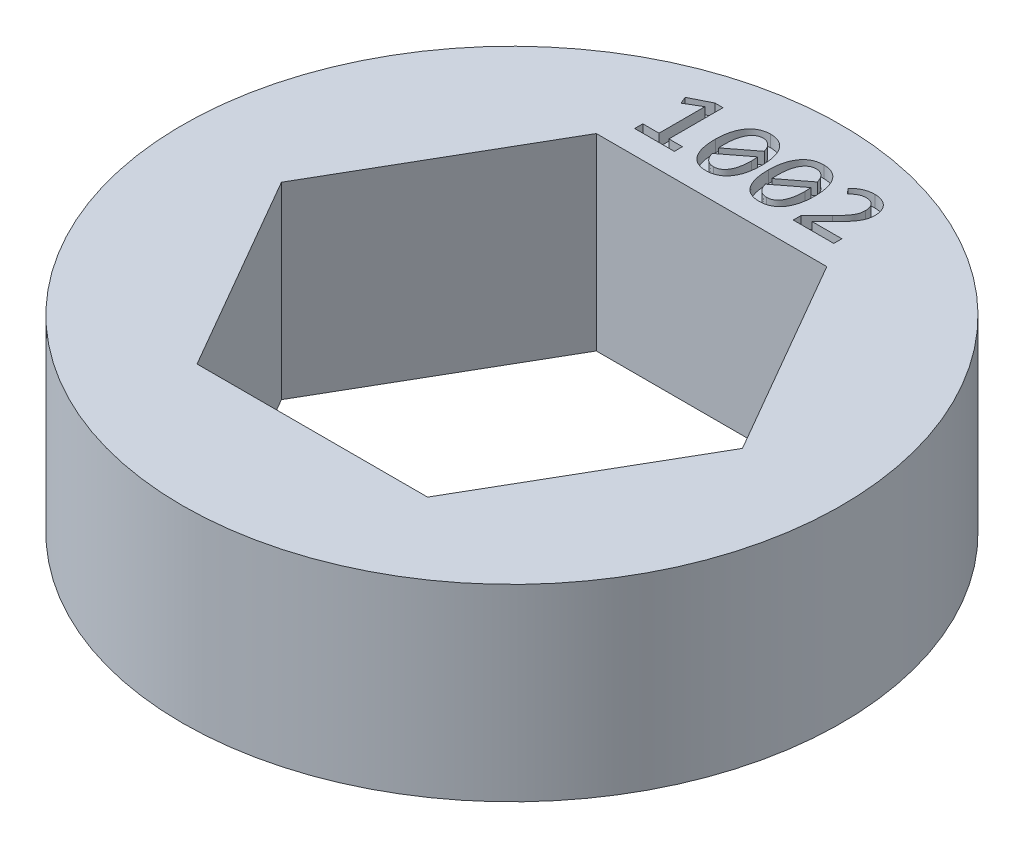
from build123d import *

# Parameters (mm, degrees)
SKETCH1_R           = 11.1125
BOSS_EXTRUDE1_DEPTH = 6.35
CUT_EXTRUDE1_DEPTH  = 0.4


with BuildPart() as part:
    # Sketch1 → Boss-Extrude1 (new body)
    with BuildSketch(Plane(origin=(0, 0, 0), x_dir=(1, 0, 0), z_dir=(0, 1, 0))):
        with Locations(Location((0, 0, 0), (0, 0, 270))):
            Circle(SKETCH1_R)
        Polygon((7.772289324, 0), (3.886144662, 6.731), (-3.886144662, 6.731), (-7.772289324, 0), (-3.886144662, -6.731), (3.886144662, -6.731), align=None, mode=Mode.SUBTRACT)
    extrude(amount=BOSS_EXTRUDE1_DEPTH)

    # Sketch2 → Cut-Extrude1 (cut)
    # profile 1 of 4: a face of its own
    with BuildSketch(Plane(origin=(0, 6.35, 0), x_dir=(1, 0, 0), z_dir=(0, 1, 0))):
        Polygon((-2.049251493, 7.52475), (-3.385828712, 7.52475), (-3.385828712, 7.798140795), (-2.839047122, 7.798140795), (-2.839047122, 9.347355299), (-3.343586037, 9.043587749), (-3.446582222, 9.286601789), (-2.776395065, 9.620746094), (-2.504902817, 9.620746094), (-2.504902817, 7.798140795), (-2.049251493, 7.798140795), align=None)
    # profile 2 of 4: a face of its own
    with BuildSketch(Plane(origin=(0, 6.35, 0), x_dir=(1, 0, 0), z_dir=(0, 1, 0))):
        with BuildLine():
            add(Edge.make_bspline(
                [(-0.165892684, 8.571798773), (-0.166325651, 8.532539667), (-0.167173732, 8.455640449), (-0.177140738, 8.343154692), (-0.192029215, 8.235790499), (-0.213292587, 8.133952321), (-0.240272581, 8.037990717), (-0.274910407, 7.94907057), (-0.314865217, 7.866804514), (-0.36154288, 7.791798506), (-0.414321619, 7.724560589), (-0.47324158, 7.664946723), (-0.538399911, 7.613533187), (-0.609814661, 7.570502981), (-0.68721939, 7.535730504), (-0.771505487, 7.511991642), (-0.861946132, 7.496719325), (-0.924455141, 7.495170599), (-0.956637587, 7.494373245)],
                knots=[0, 0, 0, 0, 1.248871528, 2.446241243, 3.590357027, 4.69618527, 5.754202854, 6.758290001, 7.728669934, 8.660396172, 9.563796911, 10.443071522, 11.321307858, 12.197637495, 13.090115231, 14.012601613, 14.976798049, 16, 16, 16, 16], degree=3))
            add(Edge.make_bspline(
                [(-0.956637587, 7.494373245), (-0.984523883, 7.495052085), (-1.039450838, 7.49638918), (-1.119857224, 7.508449964), (-1.196306294, 7.528578979), (-1.268936867, 7.555832092), (-1.33687734, 7.592268051), (-1.399769911, 7.637185139), (-1.457884215, 7.690364794), (-1.510227055, 7.752740329), (-1.557317942, 7.823677829), (-1.598168065, 7.90395186), (-1.633485499, 7.992818781), (-1.663637227, 8.090645609), (-1.686393921, 8.197912899), (-1.703489664, 8.314242635), (-1.713327632, 8.43999634), (-1.714500293, 8.526849228), (-1.715107188, 8.571798773)],
                knots=[0, 0, 0, 0, 0.897102697, 1.767001224, 2.609309556, 3.43771295, 4.257811968, 5.082953918, 5.919052252, 6.786174452, 7.6970727, 8.653553743, 9.679470751, 10.771494031, 11.944028827, 13.204944144, 14.553456404, 16, 16, 16, 16], degree=3))
            add(Edge.make_bspline(
                [(-1.715107188, 8.571798773), (-1.71439973, 8.61105018), (-1.713011452, 8.688075074), (-1.704182638, 8.80098373), (-1.688450082, 8.908608048), (-1.666850285, 9.010640269), (-1.638993202, 9.106716551), (-1.604965465, 9.195993499), (-1.56504748, 9.278286577), (-1.518887126, 9.353393458), (-1.466343023, 9.420893929), (-1.407260963, 9.480522767), (-1.342058547, 9.532107187), (-1.270210211, 9.574984835), (-1.192479257, 9.609682096), (-1.108222811, 9.633455575), (-1.01826503, 9.648757906), (-0.956228477, 9.650320298), (-0.924362285, 9.651122849)],
                knots=[0, 0, 0, 0, 1.248165713, 2.449334701, 3.598380242, 4.704508407, 5.763215836, 6.776019403, 7.739017366, 8.667464557, 9.574217704, 10.452902578, 11.330549874, 12.210601904, 13.107080692, 14.028948355, 14.987533857, 16, 16, 16, 16], degree=3))
            add(Edge.make_bspline(
                [(-0.924362285, 9.651122849), (-0.896475332, 9.65044401), (-0.841547085, 9.649106917), (-0.761301786, 9.637068879), (-0.684906628, 9.616988523), (-0.612566496, 9.588928446), (-0.544255062, 9.55306767), (-0.481529832, 9.507650243), (-0.423570481, 9.4541749), (-0.371366128, 9.391384812), (-0.324102603, 9.320190323), (-0.282877316, 9.240086592), (-0.247896786, 9.150892646), (-0.21811261, 9.053170973), (-0.194357973, 8.94609034), (-0.177578445, 8.829814678), (-0.16764054, 8.703922163), (-0.166489433, 8.616908067), (-0.165892684, 8.571798773)],
                knots=[0, 0, 0, 0, 0.896490568, 1.765795528, 2.602608418, 3.432274242, 4.256303472, 5.076742829, 5.915718828, 6.786140009, 7.696416714, 8.659101079, 9.677705081, 10.773848187, 11.941709476, 13.20176442, 14.549356535, 16, 16, 16, 16], degree=3))
        make_face()
        with BuildLine():
            add(Edge.make_bspline(
                [(-0.469660234, 8.555661122), (-0.469767537, 8.573863715), (-0.469981394, 8.610141868), (-0.474024404, 8.66420242), (-0.477403908, 8.717562964), (-0.480799232, 8.752800822), (-0.482475427, 8.770196954)],
                knots=[0, 0, 0, 0, 1.015676625, 2.024265076, 3.024624451, 4, 4, 4, 4], degree=3))
            Line((-0.482475427, 8.770196954), (-1.352010038, 8.101908345))
            add(Edge.make_bspline(
                [(-1.352010038, 8.101908345), (-1.34345071, 8.076265996), (-1.326662373, 8.025970882), (-1.294265101, 7.955066462), (-1.254555089, 7.89173888), (-1.206818183, 7.837824622), (-1.151314915, 7.794527876), (-1.099629529, 7.766900506), (-1.054544191, 7.751966897), (-1.018409114, 7.743163446), (-0.979846281, 7.738703342), (-0.953482359, 7.737832032), (-0.940025299, 7.737387285)],
                knots=[0, 0, 0, 0, 1.361870802, 2.671184605, 3.91877896, 5.116024374, 6.280451232, 7.450298556, 8.047911377, 8.670688444, 9.321473259, 10, 10, 10, 10], degree=3))
            add(Edge.make_bspline(
                [(-0.940025299, 7.737387285), (-0.922568023, 7.737990031), (-0.888151282, 7.739178334), (-0.837940335, 7.749690283), (-0.790019018, 7.765595868), (-0.744956902, 7.788922519), (-0.702437868, 7.81819234), (-0.664088949, 7.855043255), (-0.627980083, 7.897005683), (-0.595887758, 7.945833557), (-0.56696193, 8.000716962), (-0.54122657, 8.061797586), (-0.519690508, 8.129212654), (-0.501773845, 8.20284563), (-0.487029219, 8.282354818), (-0.476801204, 8.368116723), (-0.470554024, 8.459848262), (-0.469964364, 8.523058842), (-0.469660234, 8.555661122)],
                knots=[0, 0, 0, 0, 0.796240393, 1.569775284, 2.332781704, 3.095240773, 3.878796528, 4.681173991, 5.516437293, 6.40201063, 7.34239963, 8.345981007, 9.424260963, 10.57011489, 11.804224653, 13.114209461, 14.5115885, 16, 16, 16, 16], degree=3))
        make_face(mode=Mode.SUBTRACT)
        with BuildLine():
            add(Edge.make_bspline(
                [(-1.411339638, 8.575121231), (-1.411359377, 8.558192429), (-1.411398856, 8.524334087), (-1.411104532, 8.473852915), (-1.409430028, 8.424119907), (-1.406576912, 8.391427549), (-1.40516936, 8.375299139)],
                knots=[0, 0, 0, 0, 1.015676347, 2.03139705, 3.028811753, 4, 4, 4, 4], degree=3))
            Line((-1.40516936, 8.375299139), (-0.535160112, 9.043587749))
            add(Edge.make_bspline(
                [(-0.535160112, 9.043587749), (-0.543388282, 9.06962101), (-0.55938939, 9.120247212), (-0.593277284, 9.190237885), (-0.631981209, 9.253403948), (-0.679714875, 9.306455436), (-0.733736714, 9.350825781), (-0.785361246, 9.377733147), (-0.829524865, 9.3935938), (-0.864965959, 9.402303753), (-0.902414282, 9.406781166), (-0.927991087, 9.407661784), (-0.940974573, 9.408108809)],
                knots=[0, 0, 0, 0, 1.387569518, 2.698370158, 3.946895934, 5.144331536, 6.312393877, 7.486406228, 8.084826247, 8.697958228, 9.339048001, 10, 10, 10, 10], degree=3))
            add(Edge.make_bspline(
                [(-0.940974573, 9.408108809), (-0.958425679, 9.407488034), (-0.992830258, 9.406264186), (-1.04303389, 9.396031422), (-1.090739, 9.379139534), (-1.13598574, 9.355773608), (-1.178581811, 9.325843448), (-1.217031274, 9.288351162), (-1.253677288, 9.245695765), (-1.285520627, 9.19530522), (-1.314500544, 9.139278924), (-1.339775267, 9.076800562), (-1.361156549, 9.008131554), (-1.379940417, 8.933425934), (-1.393792523, 8.852471795), (-1.404251708, 8.765520689), (-1.410428728, 8.672353508), (-1.411029772, 8.60819695), (-1.411339638, 8.575121231)],
                knots=[0, 0, 0, 0, 0.786453526, 1.550480632, 2.299704824, 3.062398082, 3.840423392, 4.637837687, 5.478332318, 6.370910143, 7.318703432, 8.320397478, 9.40580758, 10.560070273, 11.791787257, 13.106920475, 14.508481623, 16, 16, 16, 16], degree=3))
        make_face(mode=Mode.SUBTRACT)
    # profile 3 of 4: a face of its own
    with BuildSketch(Plane(origin=(0, 6.35, 0), x_dir=(1, 0, 0), z_dir=(0, 1, 0))):
        with BuildLine():
            add(Edge.make_bspline(
                [(1.62633586, 8.571798773), (1.625902893, 8.532539667), (1.625054812, 8.455640449), (1.615087806, 8.343154692), (1.600199328, 8.235790499), (1.578935957, 8.133952321), (1.551955963, 8.037990717), (1.517318137, 7.94907057), (1.477363327, 7.866804514), (1.430685663, 7.791798506), (1.377906925, 7.724560589), (1.318986964, 7.664946723), (1.253828633, 7.613533187), (1.182413883, 7.570502981), (1.105009154, 7.535730504), (1.020723057, 7.511991642), (0.930282412, 7.496719325), (0.867773403, 7.495170599), (0.835590957, 7.494373245)],
                knots=[0, 0, 0, 0, 1.248871528, 2.446241243, 3.590357027, 4.69618527, 5.754202854, 6.758290001, 7.728669934, 8.660396172, 9.563796911, 10.443071522, 11.321307858, 12.197637495, 13.090115231, 14.012601613, 14.976798049, 16, 16, 16, 16], degree=3))
            add(Edge.make_bspline(
                [(0.835590957, 7.494373245), (0.807704661, 7.495052085), (0.752777706, 7.49638918), (0.67237132, 7.508449964), (0.59592225, 7.528578979), (0.523291677, 7.555832092), (0.455351204, 7.592268051), (0.392458633, 7.637185139), (0.334344328, 7.690364794), (0.282001489, 7.752740329), (0.234910602, 7.823677829), (0.194060479, 7.90395186), (0.158743045, 7.992818781), (0.128591317, 8.090645609), (0.105834623, 8.197912899), (0.08873888, 8.314242635), (0.078900912, 8.43999634), (0.077728251, 8.526849228), (0.077121356, 8.571798773)],
                knots=[0, 0, 0, 0, 0.897102697, 1.767001224, 2.609309556, 3.43771295, 4.257811968, 5.082953918, 5.919052252, 6.786174452, 7.6970727, 8.653553743, 9.679470751, 10.771494031, 11.944028827, 13.204944144, 14.553456404, 16, 16, 16, 16], degree=3))
            add(Edge.make_bspline(
                [(0.077121356, 8.571798773), (0.077828814, 8.61105018), (0.079217092, 8.688075074), (0.088045906, 8.80098373), (0.103778462, 8.908608048), (0.125378259, 9.010640269), (0.153235342, 9.106716551), (0.187263079, 9.195993499), (0.227181064, 9.278286577), (0.273341418, 9.353393458), (0.325885521, 9.420893929), (0.384967581, 9.480522767), (0.450169997, 9.532107187), (0.522018333, 9.574984835), (0.599749287, 9.609682096), (0.684005733, 9.633455575), (0.773963514, 9.648757906), (0.836000067, 9.650320298), (0.867866259, 9.651122849)],
                knots=[0, 0, 0, 0, 1.248165713, 2.449334701, 3.598380242, 4.704508407, 5.763215836, 6.776019403, 7.739017366, 8.667464557, 9.574217704, 10.452902578, 11.330549874, 12.210601904, 13.107080692, 14.028948355, 14.987533857, 16, 16, 16, 16], degree=3))
            add(Edge.make_bspline(
                [(0.867866259, 9.651122849), (0.895753212, 9.65044401), (0.950681459, 9.649106917), (1.030926758, 9.637068879), (1.107321916, 9.616988523), (1.179662048, 9.588928446), (1.247973482, 9.55306767), (1.310698712, 9.507650243), (1.368658063, 9.4541749), (1.420862416, 9.391384812), (1.468125941, 9.320190323), (1.509351228, 9.240086592), (1.544331758, 9.150892646), (1.574115934, 9.053170973), (1.597870571, 8.94609034), (1.614650099, 8.829814678), (1.624588004, 8.703922163), (1.625739111, 8.616908067), (1.62633586, 8.571798773)],
                knots=[0, 0, 0, 0, 0.896490568, 1.765795528, 2.602608418, 3.432274242, 4.256303472, 5.076742829, 5.915718828, 6.786140009, 7.696416714, 8.659101079, 9.677705081, 10.773848187, 11.941709476, 13.20176442, 14.549356535, 16, 16, 16, 16], degree=3))
        make_face()
        with BuildLine():
            add(Edge.make_bspline(
                [(1.32256831, 8.555661122), (1.322461007, 8.573863715), (1.322247149, 8.610141868), (1.31820414, 8.66420242), (1.314824636, 8.717562964), (1.311429311, 8.752800822), (1.309753117, 8.770196954)],
                knots=[0, 0, 0, 0, 1.015676625, 2.024265076, 3.024624451, 4, 4, 4, 4], degree=3))
            Line((1.309753117, 8.770196954), (0.440218505, 8.101908345))
            add(Edge.make_bspline(
                [(0.440218505, 8.101908345), (0.448777834, 8.076265996), (0.465566171, 8.025970882), (0.497963443, 7.955066462), (0.537673455, 7.89173888), (0.585410361, 7.837824622), (0.640913629, 7.794527876), (0.692599015, 7.766900506), (0.737684353, 7.751966897), (0.77381943, 7.743163446), (0.812382263, 7.738703342), (0.838746185, 7.737832032), (0.852203245, 7.737387285)],
                knots=[0, 0, 0, 0, 1.361870802, 2.671184605, 3.91877896, 5.116024374, 6.280451232, 7.450298556, 8.047911377, 8.670688444, 9.321473259, 10, 10, 10, 10], degree=3))
            add(Edge.make_bspline(
                [(0.852203245, 7.737387285), (0.86966052, 7.737990031), (0.904077262, 7.739178334), (0.954288209, 7.749690283), (1.002209526, 7.765595868), (1.047271642, 7.788922519), (1.089790676, 7.81819234), (1.128139595, 7.855043255), (1.164248461, 7.897005683), (1.196340786, 7.945833557), (1.225266614, 8.000716962), (1.251001974, 8.061797586), (1.272538036, 8.129212654), (1.290454699, 8.20284563), (1.305199325, 8.282354818), (1.31542734, 8.368116723), (1.32167452, 8.459848262), (1.32226418, 8.523058842), (1.32256831, 8.555661122)],
                knots=[0, 0, 0, 0, 0.796240393, 1.569775284, 2.332781704, 3.095240773, 3.878796528, 4.681173991, 5.516437293, 6.40201063, 7.34239963, 8.345981007, 9.424260963, 10.57011489, 11.804224653, 13.114209461, 14.5115885, 16, 16, 16, 16], degree=3))
        make_face(mode=Mode.SUBTRACT)
        with BuildLine():
            add(Edge.make_bspline(
                [(0.380888906, 8.575121231), (0.380869167, 8.558192429), (0.380829688, 8.524334087), (0.381124012, 8.473852915), (0.382798516, 8.424119907), (0.385651632, 8.391427549), (0.387059184, 8.375299139)],
                knots=[0, 0, 0, 0, 1.015676347, 2.03139705, 3.028811753, 4, 4, 4, 4], degree=3))
            Line((0.387059184, 8.375299139), (1.257068432, 9.043587749))
            add(Edge.make_bspline(
                [(1.257068432, 9.043587749), (1.248840262, 9.06962101), (1.232839154, 9.120247212), (1.19895126, 9.190237885), (1.160247335, 9.253403948), (1.112513669, 9.306455436), (1.05849183, 9.350825781), (1.006867298, 9.377733147), (0.962703679, 9.3935938), (0.927262585, 9.402303753), (0.889814262, 9.406781166), (0.864237457, 9.407661784), (0.851253971, 9.408108809)],
                knots=[0, 0, 0, 0, 1.387569518, 2.698370158, 3.946895934, 5.144331536, 6.312393877, 7.486406228, 8.084826247, 8.697958228, 9.339048001, 10, 10, 10, 10], degree=3))
            add(Edge.make_bspline(
                [(0.851253971, 9.408108809), (0.833802865, 9.407488034), (0.799398286, 9.406264186), (0.749194653, 9.396031422), (0.701489544, 9.379139534), (0.656242804, 9.355773608), (0.613646733, 9.325843448), (0.57519727, 9.288351162), (0.538551256, 9.245695765), (0.506707917, 9.19530522), (0.477728, 9.139278924), (0.452453277, 9.076800562), (0.431071995, 9.008131554), (0.412288127, 8.933425934), (0.398436021, 8.852471795), (0.387976836, 8.765520689), (0.381799816, 8.672353508), (0.381198772, 8.60819695), (0.380888906, 8.575121231)],
                knots=[0, 0, 0, 0, 0.786453526, 1.550480632, 2.299704824, 3.062398082, 3.840423392, 4.637837687, 5.478332318, 6.370910143, 7.318703432, 8.320397478, 9.40580758, 10.560070273, 11.791787257, 13.106920475, 14.508481623, 16, 16, 16, 16], degree=3))
        make_face(mode=Mode.SUBTRACT)
    # profile 4 of 4: a face of its own
    with BuildSketch(Plane(origin=(0, 6.35, 0), x_dir=(1, 0, 0), z_dir=(0, 1, 0))):
        with BuildLine():
            Line((3.327434139, 7.52475), (1.960480165, 7.52475))
            Line((1.960480165, 7.52475), (1.960480165, 7.782477781))
            Line((1.960480165, 7.782477781), (2.488276283, 8.31596954))
            add(Edge.make_bspline(
                [(2.488276283, 8.31596954), (2.508856672, 8.336998123), (2.548298728, 8.377299136), (2.604696245, 8.435347389), (2.653934405, 8.490209767), (2.697953154, 8.540684284), (2.736959439, 8.587884213), (2.770485818, 8.633115183), (2.800346725, 8.675669325), (2.824913215, 8.716827511), (2.846461872, 8.755981526), (2.863036334, 8.794338131), (2.877636758, 8.831083176), (2.889824861, 8.87995641), (2.900301143, 8.942839192), (2.901528462, 8.994015064), (2.902159569, 9.020330546)],
                knots=[0, 0, 0, 0, 1.467801241, 2.813022554, 4.036721291, 5.144444768, 6.153968288, 7.089984895, 7.95251278, 8.745669366, 9.480110839, 10.179673505, 10.829044045, 11.449272791, 12.688373796, 14, 14, 14, 14], degree=3))
            add(Edge.make_bspline(
                [(2.902159569, 9.020330546), (2.901169911, 9.045725543), (2.899221731, 9.095716564), (2.88598038, 9.156556594), (2.871107257, 9.202680951), (2.856219645, 9.234780435), (2.839074518, 9.265067959), (2.81909921, 9.293108045), (2.7964703, 9.318885576), (2.770206807, 9.341570562), (2.740936245, 9.361392227), (2.708291574, 9.37818424), (2.672408255, 9.391377612), (2.633357179, 9.401511256), (2.590799708, 9.407071334), (2.561385681, 9.407755284), (2.546181972, 9.408108809)],
                knots=[0, 0, 0, 0, 1.786063733, 3.515934619, 4.361143923, 5.193414643, 6.001490655, 6.8080304, 7.612645686, 8.409905662, 9.243888339, 10.095602441, 10.987157488, 11.929830611, 12.929957752, 14, 14, 14, 14], degree=3))
            add(Edge.make_bspline(
                [(2.546181972, 9.408108809), (2.524936345, 9.407352601), (2.48295222, 9.405858235), (2.421481772, 9.394791601), (2.362869113, 9.37620896), (2.307804019, 9.349669433), (2.255578084, 9.317408767), (2.205192095, 9.281385491), (2.15680831, 9.24088322), (2.127001972, 9.210749955), (2.111889303, 9.195471524)],
                knots=[0, 0, 0, 0, 1.023997976, 2.023553336, 3.000587663, 3.979882544, 4.962380846, 5.957326575, 6.964305914, 8, 8, 8, 8], degree=3))
            Line((2.111889303, 9.195471524), (1.960480165, 9.378206691))
            add(Edge.make_bspline(
                [(1.960480165, 9.378206691), (1.980357124, 9.398232516), (2.019987051, 9.438159245), (2.086003486, 9.49066269), (2.156007036, 9.537364058), (2.230423174, 9.578274869), (2.310550504, 9.611502021), (2.397192491, 9.634537162), (2.489880187, 9.648473719), (2.553725942, 9.650223774), (2.5865261, 9.651122849)],
                knots=[0, 0, 0, 0, 0.961904287, 1.917808245, 2.871393154, 3.830279184, 4.810558542, 5.822670133, 6.881417188, 8, 8, 8, 8], degree=3))
            add(Edge.make_bspline(
                [(2.5865261, 9.651122849), (2.609023054, 9.650786191), (2.653063518, 9.650127142), (2.717449183, 9.641456303), (2.779098767, 9.629127314), (2.837239704, 9.610347916), (2.892287442, 9.587559038), (2.943622526, 9.560320119), (2.990606287, 9.527432944), (3.033792647, 9.490499089), (3.073142689, 9.449075639), (3.107202328, 9.402569033), (3.137461609, 9.352259502), (3.161812986, 9.297266178), (3.182247708, 9.238858956), (3.19543655, 9.176311559), (3.204457642, 9.110457727), (3.205429398, 9.065295426), (3.205927119, 9.042163839)],
                knots=[0, 0, 0, 0, 1.101119101, 2.155571603, 3.176926796, 4.176889981, 5.142604225, 6.092612713, 7.016989052, 7.945805093, 8.872290513, 9.808448578, 10.764035296, 11.742108021, 12.749341803, 13.789111775, 14.867609617, 16, 16, 16, 16], degree=3))
            add(Edge.make_bspline(
                [(3.205927119, 9.042163839), (3.205560031, 9.022533499), (3.20483611, 8.983821231), (3.199184119, 8.926819209), (3.189142312, 8.872107749), (3.175324725, 8.819422799), (3.15726883, 8.768046482), (3.136202595, 8.716774969), (3.110181817, 8.6659649), (3.080709044, 8.614845163), (3.046617361, 8.563703833), (3.009369041, 8.511152374), (2.966573924, 8.458762837), (2.920681439, 8.404358017), (2.869765505, 8.349010333), (2.815892331, 8.290264132), (2.756798138, 8.22971148), (2.715822186, 8.188571499), (2.694743289, 8.167408223)],
                knots=[0, 0, 0, 0, 0.902990484, 1.780754108, 2.631610674, 3.459590136, 4.283625367, 5.135197631, 6.007543003, 6.907624824, 7.848341594, 8.83404703, 9.869576246, 10.959028296, 12.108116138, 13.328740157, 14.625847426, 16, 16, 16, 16], degree=3))
            Line((2.694743289, 8.167408223), (2.325001225, 7.798140795))
            Line((2.325001225, 7.798140795), (3.327434139, 7.798140795))
            Line((3.327434139, 7.798140795), (3.327434139, 7.52475))
        make_face()
    extrude(amount=-CUT_EXTRUDE1_DEPTH, mode=Mode.SUBTRACT)


solid = part.part
